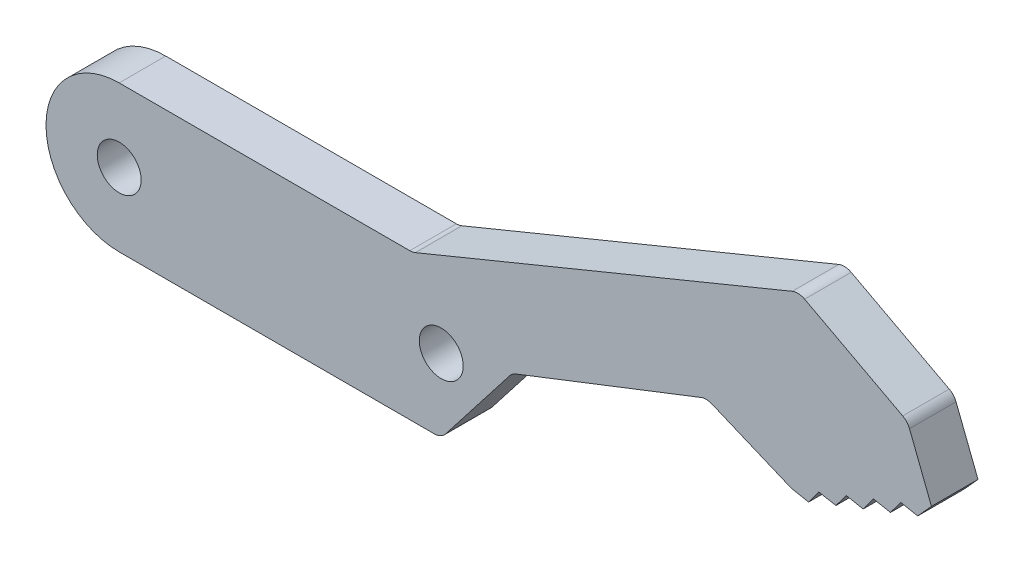
from build123d import *

# Parameters (mm, degrees)
SKETCH2_R           = 1.5
BOSS_EXTRUDE1_DEPTH = 3.18
FILLET1_R           = 1


with BuildPart() as part:
    # Sketch2 → Boss-Extrude1 (new body)
    # profile 1 of 7: a face of its own
    with BuildSketch(Plane.XY):
        with BuildLine():
            Line((20.05, 5), (0, 5))
            ThreePointArc((0, 5), (-5, 0), (0, -5))
            Line((0, -5), (22, -5))
            Line((22, -5), (26.846033211, 1.231244133))
            ThreePointArc((26.846033211, 1.231244133), (25.069509679, 3.946911493), (22, 5))
            Line((22, 5), (20.05, 5))
        make_face()
        with Locations(Location((0, 0, 0), (0, 0, 180))):
            Circle(SKETCH2_R, mode=Mode.SUBTRACT)
        with Locations(Location((22, 0, 0), (0, 0, 180))):
            Circle(SKETCH2_R, mode=Mode.SUBTRACT)
    # profile 2 of 7: a face of its own
    with BuildSketch(Plane.XY):
        with BuildLine():
            Line((46.409029503, 15.837507263), (20.05, 5))
            Line((20.05, 5), (22, 5))
            ThreePointArc((22, 5), (25.069509679, 3.946911493), (26.846033211, 1.231244133))
            Line((26.846033211, 1.231244133), (40.112794076, 6.40528087))
            Line((40.112794076, 6.40528087), (45.93826156, 3.969125944))
            Line((45.93826156, 3.969125944), (47.80157067, 4.695816497))
            Line((47.80157067, 4.695816497), (49.66487978, 5.42250705))
            Line((49.66487978, 5.42250705), (51.528188891, 6.149197603))
            Line((51.528188891, 6.149197603), (53.391498001, 6.875888156))
            Line((53.391498001, 6.875888156), (55.48772075, 7.693415028))
            Line((55.48772075, 7.693415028), (53.852667005, 11.885860526))
            Line((53.852667005, 11.885860526), (46.409029503, 15.837507263))
        make_face()
    # profile 3 of 7: a face of its own
    with BuildSketch(Plane.XY):
        Polygon((47.80157067, 4.695816497), (45.93826156, 3.969125944), (47.097006913, 3.750187123), align=None)
    # profile 4 of 7: a face of its own
    with BuildSketch(Plane.XY):
        Polygon((49.66487978, 5.42250705), (47.80157067, 4.695816497), (48.960316023, 4.476877676), align=None)
    # profile 5 of 7: a face of its own
    with BuildSketch(Plane.XY):
        Polygon((50.823625133, 5.203568229), (51.528188891, 6.149197603), (49.66487978, 5.42250705), align=None)
    # profile 6 of 7: a face of its own
    with BuildSketch(Plane.XY):
        Polygon((52.686934243, 5.930258782), (53.391498001, 6.875888156), (51.528188891, 6.149197603), align=None)
    # profile 7 of 7: a face of its own
    with BuildSketch(Plane.XY):
        Polygon((54.550243354, 6.656949335), (55.48772075, 7.693415028), (53.391498001, 6.875888156), align=None)
    extrude(amount=BOSS_EXTRUDE1_DEPTH)

    # Fillet1
    fillet1_edges = [part.edges().sort_by_distance(p)[0] for p in [
        (22, -5, 1.59),
        (20.05, 5, 1.59),
        (46.409029503, 15.837507263, 1.59),
        (53.852667005, 11.885860526, 1.59),
        (40.112794076, 6.40528087, 1.59),
        (26.846033211, 1.231244133, 1.59),
    ]]
    fillet(fillet1_edges, radius=FILLET1_R)


solid = part.part
